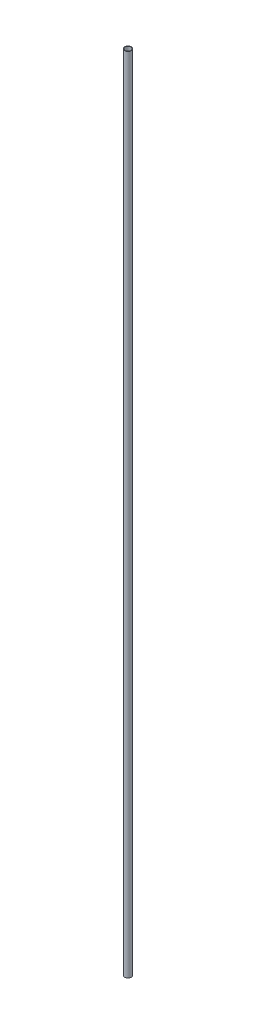
from build123d import *

# Parameters (mm, degrees)
SKETCH1_R           = 4
SKETCH1_R_2         = 3.5
BOSS_EXTRUDE1_DEPTH = 955.88


with BuildPart() as part:
    # Sketch1 → Boss-Extrude1 (new body)
    with BuildSketch(Plane(origin=(0, 0, 0), x_dir=(1, 0, 0), z_dir=(0, 1, 0))):
        with Locations(Location((0, 0, 0), (0, 0, 270))):
            Circle(SKETCH1_R)
        with Locations(Location((0, 0, 0), (0, 0, 270))):
            Circle(SKETCH1_R_2, mode=Mode.SUBTRACT)
    extrude(amount=BOSS_EXTRUDE1_DEPTH)


solid = part.part
